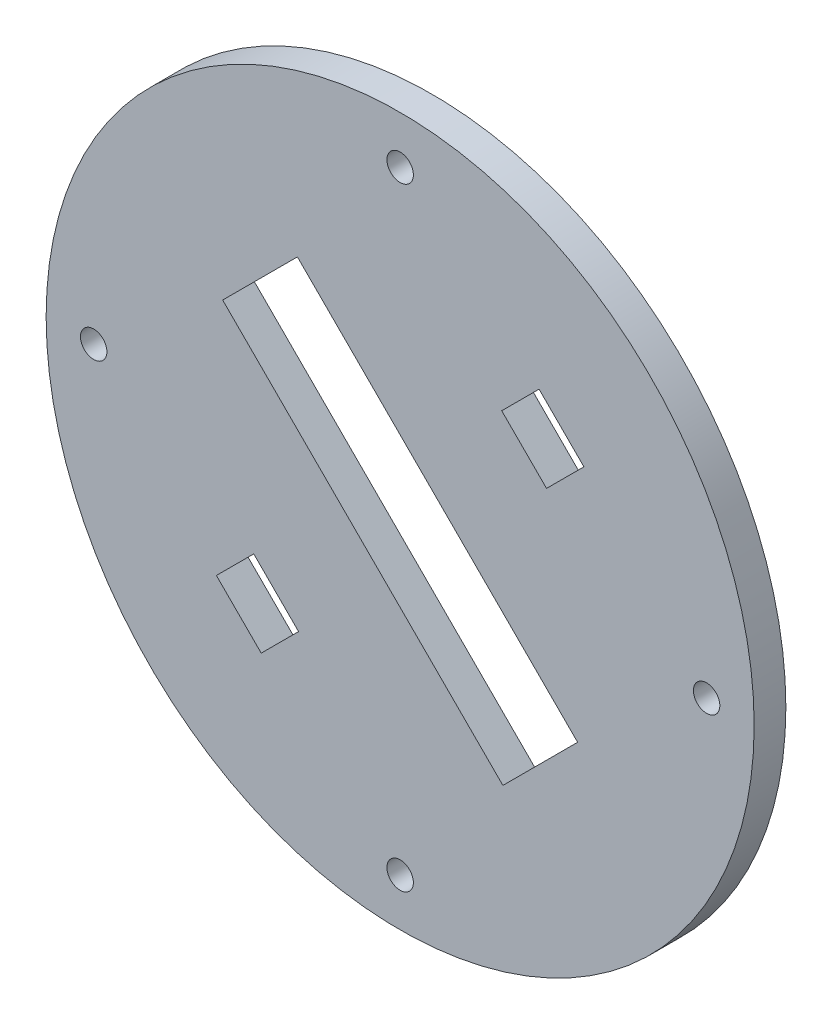
from build123d import *

# Parameters (mm, degrees)
SKETCH1_R               = 67
SKETCH1_R_2             = 2.5
BOSS_EXTRUDE1_DEPTH     = 6
CUT_EXTRUDE3_DEPTH      = 47
CUT_EXTRUDE3_DEPTH_BACK = 25
CUT_EXTRUDE6_DEPTH      = 10
CUT_EXTRUDE7_DEPTH      = 10


with BuildPart() as part:
    # Sketch1 → Boss-Extrude1 (new body)
    with BuildSketch(Plane.XY):
        Circle(SKETCH1_R)
        with Locations((0, 58)):
            Circle(SKETCH1_R_2, mode=Mode.SUBTRACT)
        with Locations((58, 0)):
            Circle(SKETCH1_R_2, mode=Mode.SUBTRACT)
        with Locations((0, -58)):
            Circle(SKETCH1_R_2, mode=Mode.SUBTRACT)
        with Locations((-58, 0)):
            Circle(SKETCH1_R_2, mode=Mode.SUBTRACT)
    extrude(amount=BOSS_EXTRUDE1_DEPTH)

    # Sketch3 → Cut-Extrude3 (cut, two sides: drawn at the far end of the back side and taken through both)
    with BuildSketch(Plane.XY.offset(6).offset(-CUT_EXTRUDE3_DEPTH_BACK)):
        Polygon((-34.424621456, -26.646446356), (-27.353553137, -19.575379051), (-19.575378544, -27.353553644), (-26.646446863, -34.424620949), align=None)
        Polygon((19.575379051, 27.353553137), (27.353553644, 19.575378544), (34.424620949, 26.646446863), (26.646446356, 34.424621456), align=None)
    extrude(amount=CUT_EXTRUDE3_DEPTH + CUT_EXTRUDE3_DEPTH_BACK, mode=Mode.SUBTRACT)

    # Sketch4 → Cut-Extrude6 (cut)
    with BuildSketch(Plane.XY.offset(6)):
        Polygon((-19.445436483, 33.587572106), (33.587572106, -19.445436483), (19.445436483, -33.587572106), (-33.587572106, 19.445436483), align=None)
    extrude(amount=-CUT_EXTRUDE6_DEPTH, mode=Mode.SUBTRACT)

    # Sketch5 → Cut-Extrude7 (cut)
    with BuildSketch(Plane.XY.offset(6)):
        Polygon((-34.424621456, -26.646446356), (-34.778174339, -26.292893473), (-27.707106527, -19.221825661), (-27.353553137, -19.575379051), align=None)
        Polygon((-26.646446863, -34.424620949), (-26.292893473, -34.778174339), (-19.221825661, -27.707106527), (-19.575378544, -27.353553644), align=None)
        Polygon((27.707106527, 19.221825661), (27.353553644, 19.575378544), (34.424620949, 26.646446863), (34.778174339, 26.292893473), align=None)
        Polygon((26.646446356, 34.424621456), (19.575379051, 27.353553137), (19.221825661, 27.707106527), (26.292893473, 34.778174339), align=None)
    extrude(amount=-CUT_EXTRUDE7_DEPTH, mode=Mode.SUBTRACT)


solid = part.part
